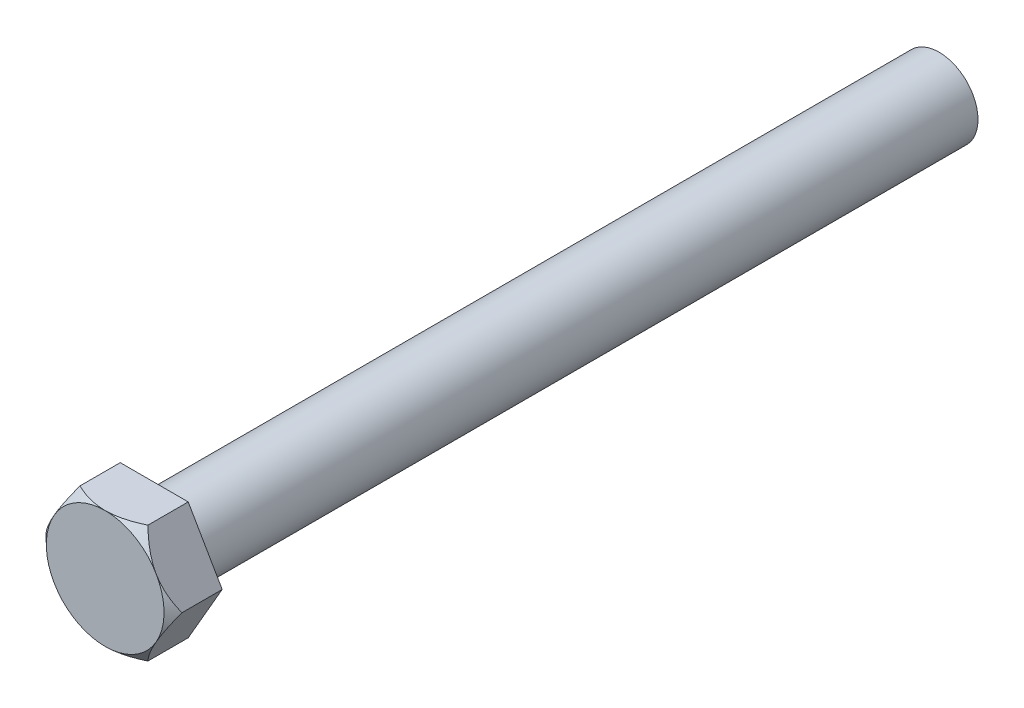
from build123d import *

# Parameters (mm, degrees)
CROQUIS1_R              = 7.9375
SALIENTE_EXTRUIR1_DEPTH = 160
SALIENTE_EXTRUIR2_DEPTH = 10
CROQUIS3_R              = 34.921607703
CROQUIS3_R_2            = 12
CORTAR_EXTRUIR1_DEPTH   = 6
CORTAR_EXTRUIR1_DRAFT   = -46


with BuildPart() as part:
    # Croquis1 → Saliente-Extruir1 (new body)
    with BuildSketch(Plane.XY):
        Circle(CROQUIS1_R)
    extrude(amount=SALIENTE_EXTRUIR1_DEPTH)

    # Croquis2 → Saliente-Extruir2 (add)
    with BuildSketch(Plane.XY.offset(160)):
        Polygon((13.856406461, 0), (6.92820323, 12), (-6.92820323, 12), (-13.856406461, 0), (-6.92820323, -12), (6.92820323, -12), align=None)
    extrude(amount=SALIENTE_EXTRUIR2_DEPTH)


with BuildPart() as cortar_extruir1_tool:
    # Croquis3 → Cortar-Extruir1 (with draft: the straight prism first)
    with BuildSketch(Plane.XY.offset(170)):
        Circle(CROQUIS3_R)
        Circle(CROQUIS3_R_2, mode=Mode.SUBTRACT)
    extrude(amount=-CORTAR_EXTRUIR1_DEPTH)
    # Cortar-Extruir1: the draft: its side faces are tilted about the plane it starts from
    cortar_extruir1_sides = [cortar_extruir1_tool.faces().sort_by_distance(p)[0] for p in [
        (-34.921607703, 0, 167),
        (-12, 0, 167),
    ]]
    draft(cortar_extruir1_sides, Plane.XY.offset(170), CORTAR_EXTRUIR1_DRAFT)


with BuildPart() as part_1:
    add(part.part)

    # Cortar-Extruir1: cut by cortar_extruir1_tool
    add(cortar_extruir1_tool.part, mode=Mode.SUBTRACT)


solid = part_1.part
